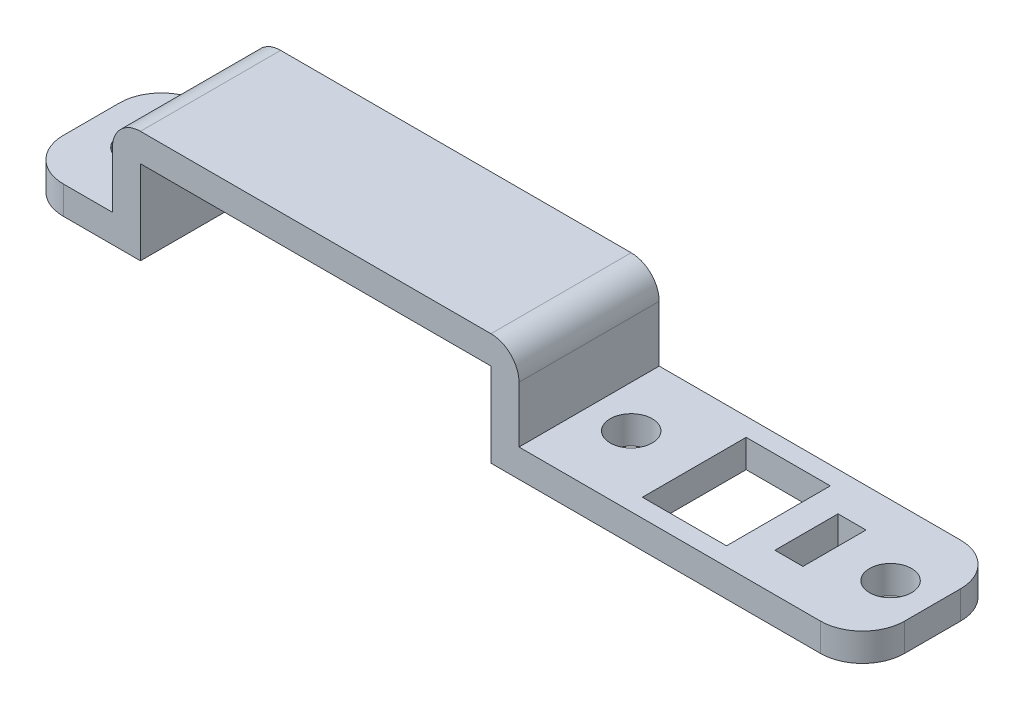
from build123d import *

# Parameters (mm, degrees)
EXTRUIR_L_MINA1_DEPTH = 10
CROQUIS2_R            = 1.5
CORTAR_EXTRUIR1_DEPTH = 61.141499815
REDONDEO2_R           = 3
REDONDEO3_R           = 2
CROQUIS3_W            = 6
CROQUIS3_H            = 7.4
CROQUIS3_W_2          = 2
CROQUIS3_H_2          = 4.5
CORTAR_EXTRUIR2_DEPTH = 61.141499815


with BuildPart() as part:
    # Croquis1 → Extruir-Lámina1 (new body)
    with BuildSketch(Plane.XY):
        Polygon((-1, 0), (0, 0), (7.5, 0), (7.5, 6), (32.5, 6), (32.5, 0), (41.5, 0), (59, 0), (59, 2), (41.5, 2), (34.5, 2), (34.5, 8), (5.5, 8), (5.5, 2), (0, 2), (-1, 2), align=None)
    extrude(amount=-EXTRUIR_L_MINA1_DEPTH)

    # Croquis2 → Cortar-Extruir1 (cut, through all)
    with BuildSketch(Plane(origin=(0, 2, 0), x_dir=(1, 0, 0), z_dir=(0, 1, 0))):
        with Locations(Location((2.5, 5, 0), (0, 0, 270))):
            Circle(CROQUIS2_R)
        with Locations(Location((37.5, 5, 0), (0, 0, 270))):
            Circle(CROQUIS2_R)
        with Locations(Location((56, 5, 0), (0, 0, 270))):
            Circle(CROQUIS2_R)
    extrude(amount=-CORTAR_EXTRUIR1_DEPTH, mode=Mode.SUBTRACT)

    # Redondeo2
    redondeo2_edges = [part.edges().sort_by_distance(p)[0] for p in [
        (-1, 1, 0),
        (59, 1, 0),
        (-1, 1, -10),
        (59, 1, -10),
    ]]
    fillet(redondeo2_edges, radius=REDONDEO2_R)

    # Redondeo3
    redondeo3_edges = [part.edges().sort_by_distance(p)[0] for p in [
        (5.5, 8, -5),
        (34.5, 8, -5),
    ]]
    fillet(redondeo3_edges, radius=REDONDEO3_R)

    # Croquis3 → Cortar-Extruir2 (cut, through all)
    with BuildSketch(Plane(origin=(0, 2, 0), x_dir=(1, 0, 0), z_dir=(0, 1, 0))):
        with Locations((45, 5)):
            Rectangle(CROQUIS3_W, CROQUIS3_H)
        with Locations((51, 5)):
            Rectangle(CROQUIS3_W_2, CROQUIS3_H_2)
    extrude(amount=-CORTAR_EXTRUIR2_DEPTH, mode=Mode.SUBTRACT)


solid = part.part
